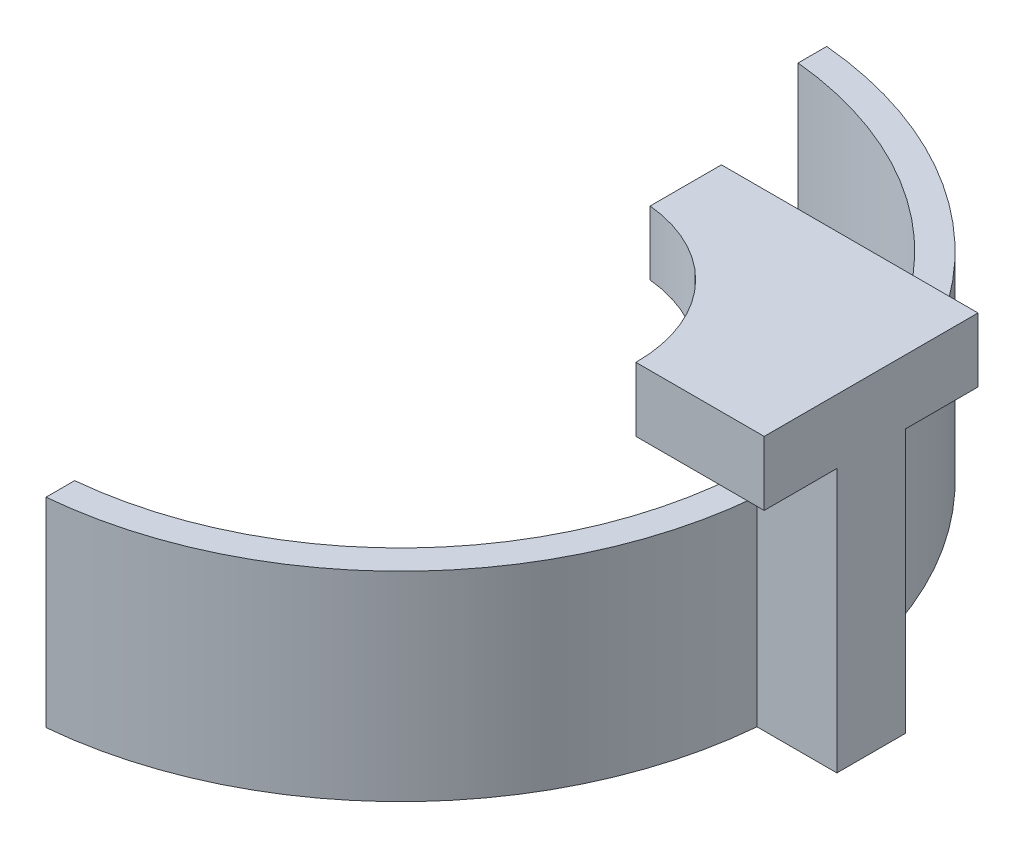
from build123d import *

# Parameters (mm, degrees)
BOSS_EXTRUDE1_DEPTH      = 12
BOSS_EXTRUDE2_START      = -2
BOSS_EXTRUDE2_DEPTH      = 2
SKETCH4_W                = 6
SKETCH4_H                = 4.8
BOSS_EXTRUDE3_DEPTH      = 20
BOSS_EXTRUDE4_DEPTH      = 3
BOSS_EXTRUDE4_DEPTH_BACK = 1.5
SKETCH5_W                = 18
SKETCH5_H                = 15
CUT_EXTRUDE1_DEPTH       = 5


with BuildPart() as part:
    # Sketch1 → Boss-Extrude1 (new body)
    with BuildSketch(Plane(origin=(0, 0, 0), x_dir=(1, 0, 0), z_dir=(0, 1, 0))):
        with BuildLine():
            Line((2.5, 27.386127875), (2.5, 25.377155081))
            ThreePointArc((2.5, 25.377155081), (25.5, 0), (2.5, -25.377155081))
            Line((2.5, -25.377155081), (2.5, -27.386127875))
            ThreePointArc((2.5, -27.386127875), (27.5, 0), (2.5, 27.386127875))
        make_face()
    extrude(amount=BOSS_EXTRUDE1_DEPTH)

    # Sketch2 → Boss-Extrude2 (add)
    with BuildSketch(Plane(origin=(0, 0, 0), x_dir=(1, 0, 0), z_dir=(0, 1, 0)).offset(BOSS_EXTRUDE2_START)):
        with BuildLine():
            Line((2.5, 27.386127875), (1.863636364, 20.415113507))
            ThreePointArc((1.863636364, 20.415113507), (20.5, 0), (1.863636364, -20.415113507))
            Line((1.863636364, -20.415113507), (2.5, -27.386127875))
            ThreePointArc((2.5, -27.386127875), (27.5, 0), (2.5, 27.386127875))
        make_face()
    extrude(amount=BOSS_EXTRUDE2_DEPTH)

    # Sketch4 → Boss-Extrude3 (add)
    with BuildSketch(Plane(origin=(0, -2, 0), x_dir=(1, 0, 0), z_dir=(0, 1, 0))):
        with Locations((30, 0)):
            Rectangle(SKETCH4_W, SKETCH4_H)
    extrude(amount=BOSS_EXTRUDE3_DEPTH)

    # Sketch5 → Boss-Extrude4 (add, two sides: drawn at the far end of the back side and taken through both)
    with BuildSketch(Plane(origin=(0, 18, 0), x_dir=(1, 0, 0), z_dir=(0, 1, 0)).offset(-BOSS_EXTRUDE4_DEPTH_BACK)):
        with Locations((24, 0)):
            Rectangle(SKETCH5_W, SKETCH5_H)
    extrude(amount=BOSS_EXTRUDE4_DEPTH + BOSS_EXTRUDE4_DEPTH_BACK)

    # Sketch6 → Cut-Extrude1 (cut)
    with BuildSketch(Plane(origin=(0, 21, 0), x_dir=(1, 0, 0), z_dir=(0, 1, 0))):
        with BuildLine():
            Line((24, -7.5), (15, -7.5))
            Line((15, -7.5), (15, 2.5))
            ThreePointArc((15, 2.5), (21.433067029, -0.760239674), (24, -7.5))
        make_face()
    extrude(amount=-CUT_EXTRUDE1_DEPTH, mode=Mode.SUBTRACT)


solid = part.part
